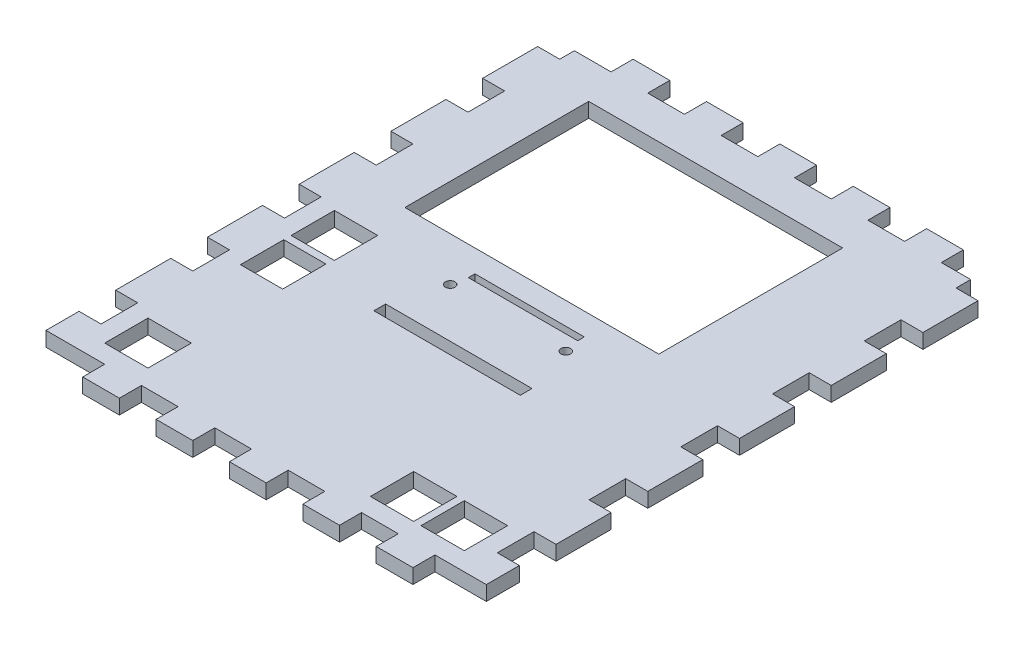
from build123d import *

# Parameters (mm, degrees)
SKETCH_1_W          = 108
SKETCH_1_H          = 138
EXTRUDE_1_DEPTH     = 4
SKETCH_2_W          = 69.21
SKETCH_2_H          = 50.1
CUT_EXTRUDE_1_DEPTH = 176.282628917
SKETCH_4_W          = 15
SKETCH_4_H          = 4
EXTRUDE_2_DEPTH     = 6
SKETCH_6_W          = 9
SKETCH_6_H          = 4
EXTRUDE_3_DEPTH     = 6
SKETCH_7_W          = 15
SKETCH_7_H          = 4
EXTRUDE_4_DEPTH     = 6
SKETCH_8_W          = 9
SKETCH_8_H          = 4
EXTRUDE_5_DEPTH     = 6
SKETCH_9_W          = 10
SKETCH_9_H          = 4
EXTRUDE_6_DEPTH     = 6
SKETCH_10_W         = 10
SKETCH_10_H         = 4
EXTRUDE_7_DEPTH     = 6
SKETCH_11_W         = 11.5
SKETCH_11_H         = 11.8
SKETCH_11_W_2       = 11.8
CUT_EXTRUDE_2_DEPTH = 184.706287318
SKETCH_12_W         = 11.8
SKETCH_12_H         = 11.8
CUT_EXTRUDE_3_DEPTH = 184.706287318
SKETCH_13_W         = 11.8
SKETCH_13_H         = 11.8
CUT_EXTRUDE_4_DEPTH = 184.706287318
SKETCH_14_R         = 1.3
SKETCH_14_W         = 29.8
SKETCH_14_H         = 1.8
SKETCH_14_W_2       = 39.9
SKETCH_14_H_2       = 3.2
CUT_EXTRUDE_5_DEPTH = 184.706287318


with BuildPart() as part:
    # Эскиз1 → Бобышка-Вытянуть1 (new body)
    with BuildSketch(Plane(origin=(0, 0, 0), x_dir=(1, 0, 0), z_dir=(0, 1, 0))):
        with Locations((54, -69)):
            Rectangle(SKETCH_1_W, SKETCH_1_H)
    extrude(amount=EXTRUDE_1_DEPTH)

    # Эскиз2 → Вырез-Вытянуть1 (cut, through all)
    with BuildSketch(Plane(origin=(0, 4, 0), x_dir=(1, 0, 0), z_dir=(0, 1, 0))):
        with Locations((48.505, -35.05)):
            Rectangle(SKETCH_2_W, SKETCH_2_H)
    extrude(amount=-CUT_EXTRUDE_1_DEPTH, mode=Mode.SUBTRACT)

    # Эскиз4 → Бобышка-Вытянуть2 (add)
    with BuildSketch(Plane.ZY):
        with Locations((11.5, 2)):
            Rectangle(SKETCH_4_W, SKETCH_4_H)
        with Locations((36.5, 2)):
            Rectangle(SKETCH_4_W, SKETCH_4_H)
        with Locations((61.5, 2)):
            Rectangle(SKETCH_4_W, SKETCH_4_H)
        with Locations((86.5, 2)):
            Rectangle(SKETCH_4_W, SKETCH_4_H)
        with Locations((111.5, 2)):
            Rectangle(SKETCH_4_W, SKETCH_4_H)
    extrude(amount=EXTRUDE_2_DEPTH)

    # Эскиз6 → Бобышка-Вытянуть3 (add)
    with BuildSketch(Plane.ZY):
        with Locations((133.5, 2)):
            Rectangle(SKETCH_6_W, SKETCH_6_H)
    extrude(amount=EXTRUDE_3_DEPTH)

    # Эскиз7 → Бобышка-Вытянуть4 (add)
    with BuildSketch(Plane(origin=(108, 0, 0), x_dir=(0, 0, -1), z_dir=(1, 0, 0))):
        with Locations((-11.5, 2)):
            Rectangle(SKETCH_7_W, SKETCH_7_H)
        with Locations((-36.5, 2)):
            Rectangle(SKETCH_7_W, SKETCH_7_H)
        with Locations((-61.5, 2)):
            Rectangle(SKETCH_7_W, SKETCH_7_H)
        with Locations((-86.5, 2)):
            Rectangle(SKETCH_7_W, SKETCH_7_H)
        with Locations((-111.5, 2)):
            Rectangle(SKETCH_7_W, SKETCH_7_H)
    extrude(amount=EXTRUDE_4_DEPTH)

    # Эскиз8 → Бобышка-Вытянуть5 (add)
    with BuildSketch(Plane(origin=(108, 0, 0), x_dir=(0, 0, -1), z_dir=(1, 0, 0))):
        with Locations((-133.5, 2)):
            Rectangle(SKETCH_8_W, SKETCH_8_H)
    extrude(amount=EXTRUDE_5_DEPTH)

    # Эскиз9 → Бобышка-Вытянуть6 (add)
    with BuildSketch(Plane(origin=(0, 0, 0), x_dir=(-1, 0, 0), z_dir=(0, 0, -1))):
        with Locations((-94.998495411, 2)):
            Rectangle(SKETCH_9_W, SKETCH_9_H)
        with Locations((-74.998495411, 2)):
            Rectangle(SKETCH_9_W, SKETCH_9_H)
        with Locations((-54.998495411, 2)):
            Rectangle(SKETCH_9_W, SKETCH_9_H)
        with Locations((-34.998495411, 2)):
            Rectangle(SKETCH_9_W, SKETCH_9_H)
        with Locations((-14.998495411, 2)):
            Rectangle(SKETCH_9_W, SKETCH_9_H)
    extrude(amount=EXTRUDE_6_DEPTH)

    # Эскиз10 → Бобышка-Вытянуть7 (add)
    with BuildSketch(Plane.XY.offset(138)):
        with Locations((15, 2)):
            Rectangle(SKETCH_10_W, SKETCH_10_H)
        with Locations((35, 2)):
            Rectangle(SKETCH_10_W, SKETCH_10_H)
        with Locations((55, 2)):
            Rectangle(SKETCH_10_W, SKETCH_10_H)
        with Locations((75, 2)):
            Rectangle(SKETCH_10_W, SKETCH_10_H)
        with Locations((95, 2)):
            Rectangle(SKETCH_10_W, SKETCH_10_H)
    extrude(amount=EXTRUDE_7_DEPTH)

    # Эскиз11 → Вырез-Вытянуть2 (cut, through all)
    with BuildSketch(Plane(origin=(0, 4, 0), x_dir=(1, 0, 0), z_dir=(0, 1, 0))):
        with Locations((10.75, -90.1)):
            Rectangle(SKETCH_11_W, SKETCH_11_H)
        with Locations((10.9, -76.3)):
            Rectangle(SKETCH_11_W_2, SKETCH_11_H)
    extrude(amount=-CUT_EXTRUDE_2_DEPTH, mode=Mode.SUBTRACT)

    # Эскиз12 → Вырез-Вытянуть3 (cut, through all)
    with BuildSketch(Plane(origin=(0, 4, 0), x_dir=(1, 0, 0), z_dir=(0, 1, 0))):
        with Locations((83.3, -127.1)):
            Rectangle(SKETCH_12_W, SKETCH_12_H)
        with Locations((97.1, -127.1)):
            Rectangle(SKETCH_12_W, SKETCH_12_H)
    extrude(amount=-CUT_EXTRUDE_3_DEPTH, mode=Mode.SUBTRACT)

    # Эскиз13 → Вырез-Вытянуть4 (cut, through all)
    with BuildSketch(Plane(origin=(0, 4, 0), x_dir=(1, 0, 0), z_dir=(0, 1, 0))):
        with Locations((10.9, -127.1)):
            Rectangle(SKETCH_13_W, SKETCH_13_H)
    extrude(amount=-CUT_EXTRUDE_4_DEPTH, mode=Mode.SUBTRACT)

    # Эскиз14 → Вырез-Вытянуть5 (cut, through all)
    with BuildSketch(Plane(origin=(0, 4, 0), x_dir=(1, 0, 0), z_dir=(0, 1, 0))):
        with Locations(Location((38.25, -72.1, 0), (0, 0, 270))):
            Circle(SKETCH_14_R)
        with Locations(Location((69.75, -72.1, 0), (0, 0, 270))):
            Circle(SKETCH_14_R)
        with Locations((54, -67.1)):
            Rectangle(SKETCH_14_W, SKETCH_14_H)
        with Locations((54, -87.1)):
            Rectangle(SKETCH_14_W_2, SKETCH_14_H_2)
    extrude(amount=-CUT_EXTRUDE_5_DEPTH, mode=Mode.SUBTRACT)


solid = part.part
